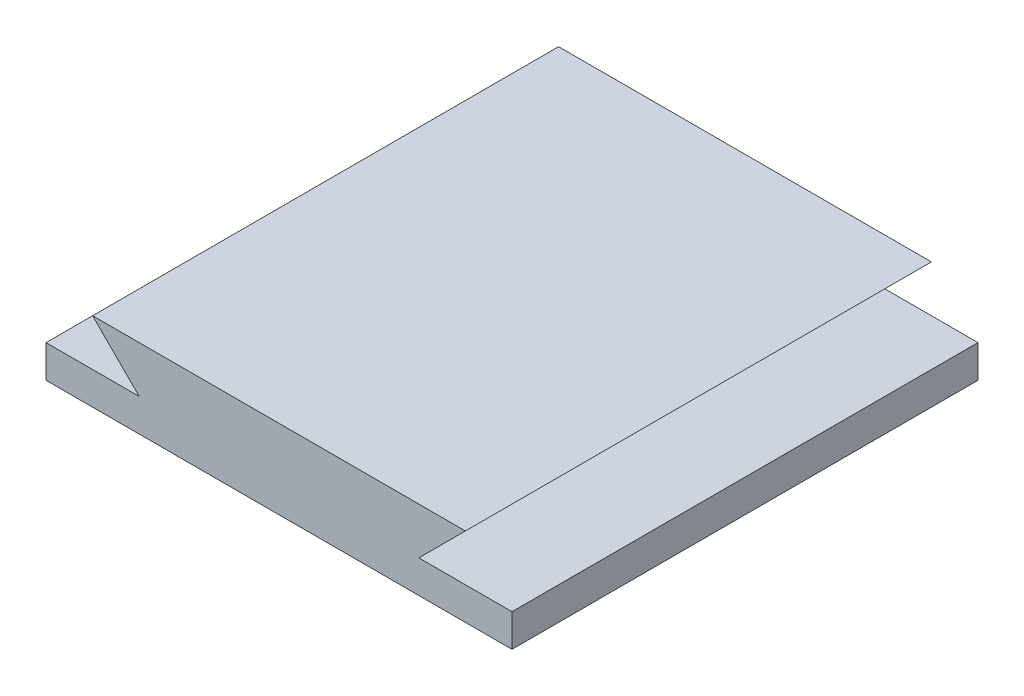
from build123d import *

# Parameters (mm, degrees)
CROQUIS1_W              = 100
CROQUIS1_H              = 7
SALIENTE_EXTRUIR1_DEPTH = 100


with BuildPart() as part:
    # Croquis1 → Saliente-Extruir1 (new body)
    with BuildSketch(Plane.XY):
        Polygon((-40, 13.5), (-30, 3.5), (30, 3.5), (40, 13.5), align=None)
        Rectangle(CROQUIS1_W, CROQUIS1_H)
    extrude(amount=SALIENTE_EXTRUIR1_DEPTH)


solid = part.part
